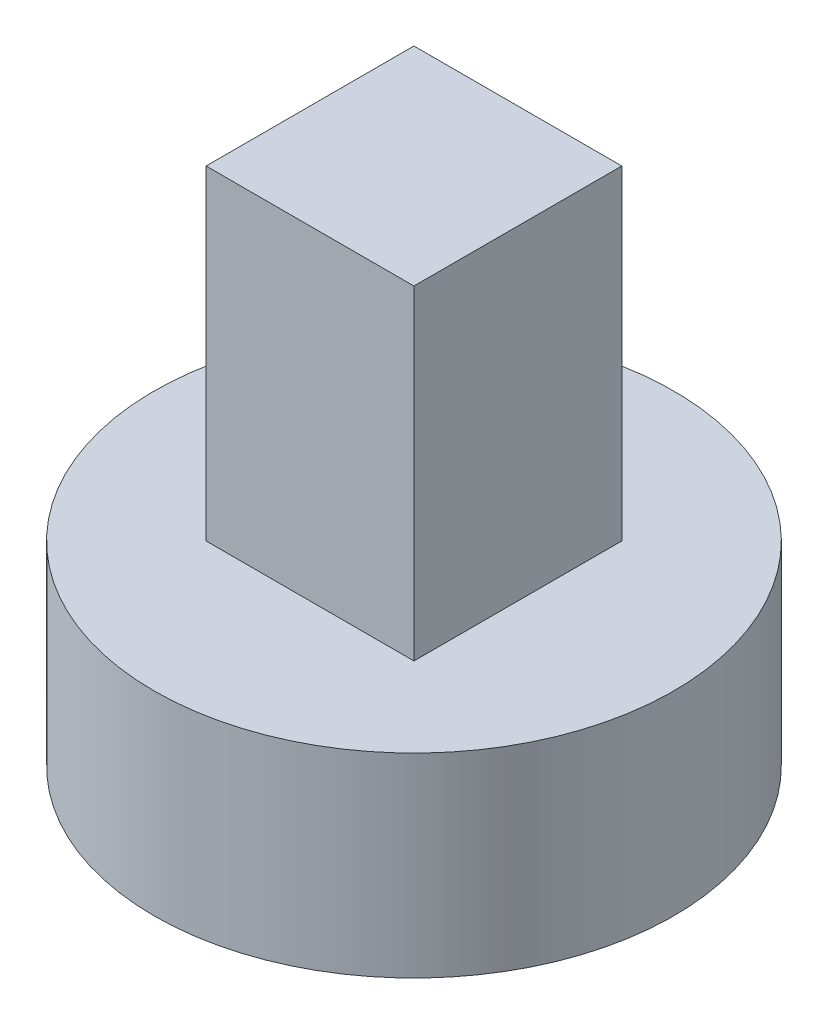
from build123d import *

# Parameters (mm, degrees)
SKETCH_1_R      = 4
EXTRUDE_1_DEPTH = 3
SKETCH_2_W      = 3.2
SKETCH_2_H      = 3.2
EXTRUDE_3_DEPTH = 5


with BuildPart() as part:
    # Эскиз1 → Бобышка-Вытянуть1 (new body)
    with BuildSketch(Plane(origin=(0, 0, 0), x_dir=(1, 0, 0), z_dir=(0, 1, 0))):
        with Locations(Location((0, 0, 0), (0, 0, 270))):
            Circle(SKETCH_1_R)
    extrude(amount=EXTRUDE_1_DEPTH)

    # Эскиз2 → Бобышка-Вытянуть3 (add)
    with BuildSketch(Plane(origin=(0, 3, 0), x_dir=(1, 0, 0), z_dir=(0, 1, 0))):
        Rectangle(SKETCH_2_W, SKETCH_2_H)
    extrude(amount=EXTRUDE_3_DEPTH)


solid = part.part
